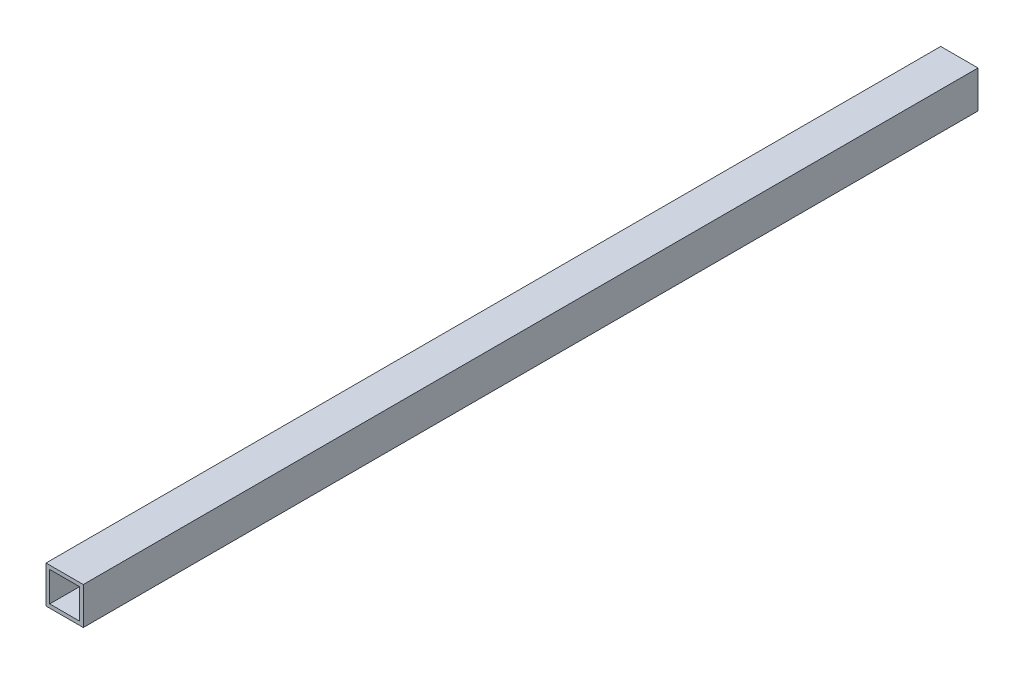
from build123d import *

# Parameters (mm, degrees)
SZKIC1_W                    = 20
SZKIC1_H                    = 20
SZKIC1_W_2                  = 16
SZKIC1_H_2                  = 16
DODANIE_WYCI_GNI_CIE1_DEPTH = 480


with BuildPart() as part:
    # Szkic1 → Dodanie-wyciągnięcie1 (new body)
    with BuildSketch(Plane.XY):
        Rectangle(SZKIC1_W, SZKIC1_H)
        Rectangle(SZKIC1_W_2, SZKIC1_H_2, mode=Mode.SUBTRACT)
    extrude(amount=DODANIE_WYCI_GNI_CIE1_DEPTH)


solid = part.part
